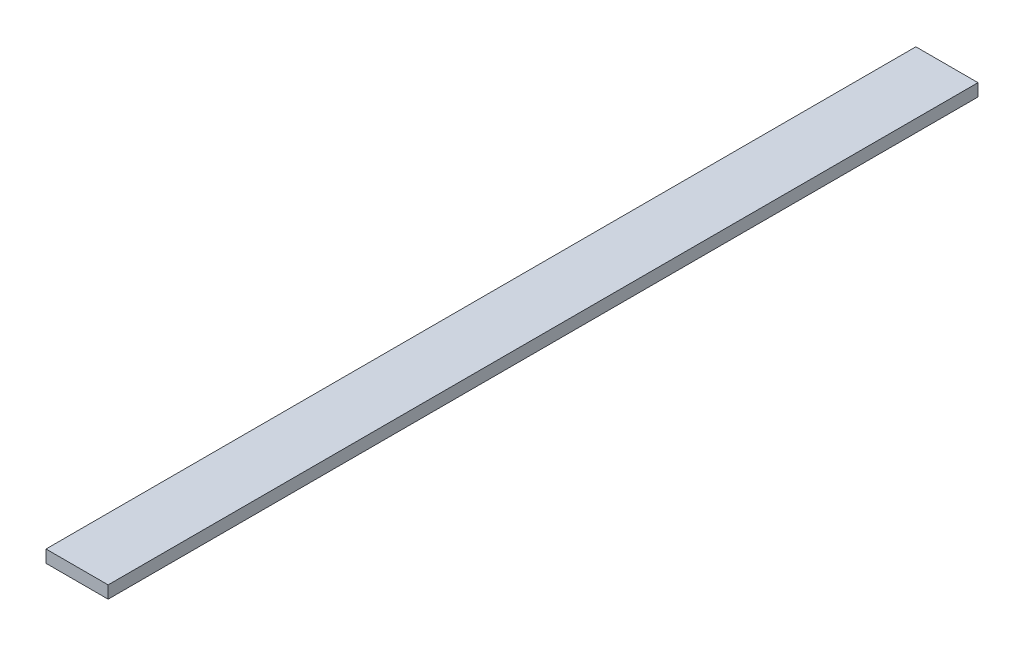
from build123d import *

# Parameters (mm, degrees)
SZKIC1_W                    = 25
SZKIC1_H                    = 350
DODANIE_WYCI_GNI_CIE1_DEPTH = 5


with BuildPart() as part:
    # Szkic1 → Dodanie-wyciągnięcie1 (new body)
    with BuildSketch(Plane(origin=(0, 0, 0), x_dir=(1, 0, 0), z_dir=(0, 1, 0))):
        Rectangle(SZKIC1_W, SZKIC1_H)
    extrude(amount=DODANIE_WYCI_GNI_CIE1_DEPTH)


solid = part.part
